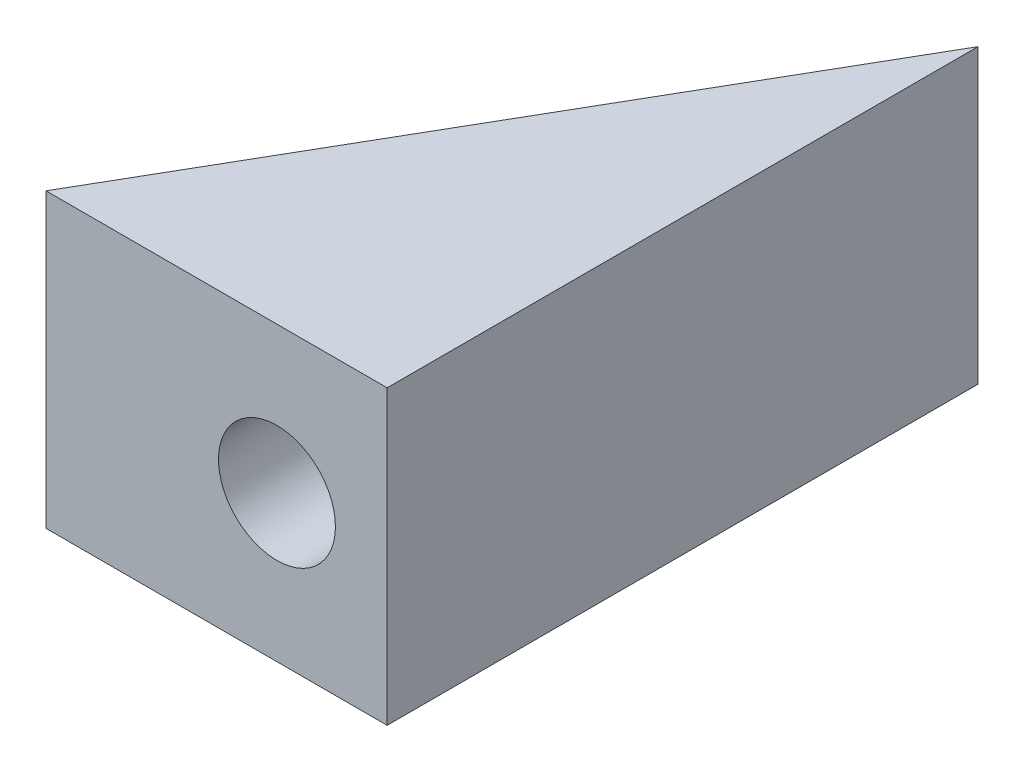
from build123d import *

# Parameters (mm, degrees)
BOSS_EXTRUDE2_DEPTH       = 10
F_4_0MM_DOWEL_HOLE1_D     = 4
F_4_0MM_DOWEL_HOLE1_DEPTH = 7
F_4_0MM_DOWEL_HOLE1_TIP   = 1.201721238
F_4_0MM_DOWEL_HOLE2_D     = 4
F_4_0MM_DOWEL_HOLE2_DEPTH = 7
F_4_0MM_DOWEL_HOLE2_TIP   = 1.201721238


with BuildPart() as part:
    # Sketch1 → Boss-Extrude2 (new body)
    with BuildSketch(Plane(origin=(0, 0, 0), x_dir=(1, 0, 0), z_dir=(0, 1, 0))):
        Polygon((-11.668829591, 0), (0, 20.211005717), (0, 0), align=None)
    extrude(amount=BOSS_EXTRUDE2_DEPTH)

    # Ø4.0mm Dowel Hole1
    with Locations(Plane(origin=(-3.768829591, 5, 0), x_dir=(1, 0, 0), z_dir=(0, 0, 1))):
        with Locations((0, 0)):
            Hole(F_4_0MM_DOWEL_HOLE1_D / 2, depth=F_4_0MM_DOWEL_HOLE1_DEPTH)
            with Locations((0, 0, -(F_4_0MM_DOWEL_HOLE1_DEPTH + F_4_0MM_DOWEL_HOLE1_TIP / 2))):  # 118° drill point
                Cone(0, F_4_0MM_DOWEL_HOLE1_D / 2, F_4_0MM_DOWEL_HOLE1_TIP, mode=Mode.SUBTRACT)

    # Ø4.0mm Dowel Hole2
    with Locations(Plane(origin=(-7.56864217, 5.29892352, -7.101732934), x_dir=(0.5, 0, -0.866025403784), z_dir=(-0.866025403784, 0, -0.5))):
        with Locations((0, 0)):
            Hole(F_4_0MM_DOWEL_HOLE2_D / 2, depth=F_4_0MM_DOWEL_HOLE2_DEPTH)
            with Locations((0, 0, -(F_4_0MM_DOWEL_HOLE2_DEPTH + F_4_0MM_DOWEL_HOLE2_TIP / 2))):  # 118° drill point
                Cone(0, F_4_0MM_DOWEL_HOLE2_D / 2, F_4_0MM_DOWEL_HOLE2_TIP, mode=Mode.SUBTRACT)


solid = part.part
